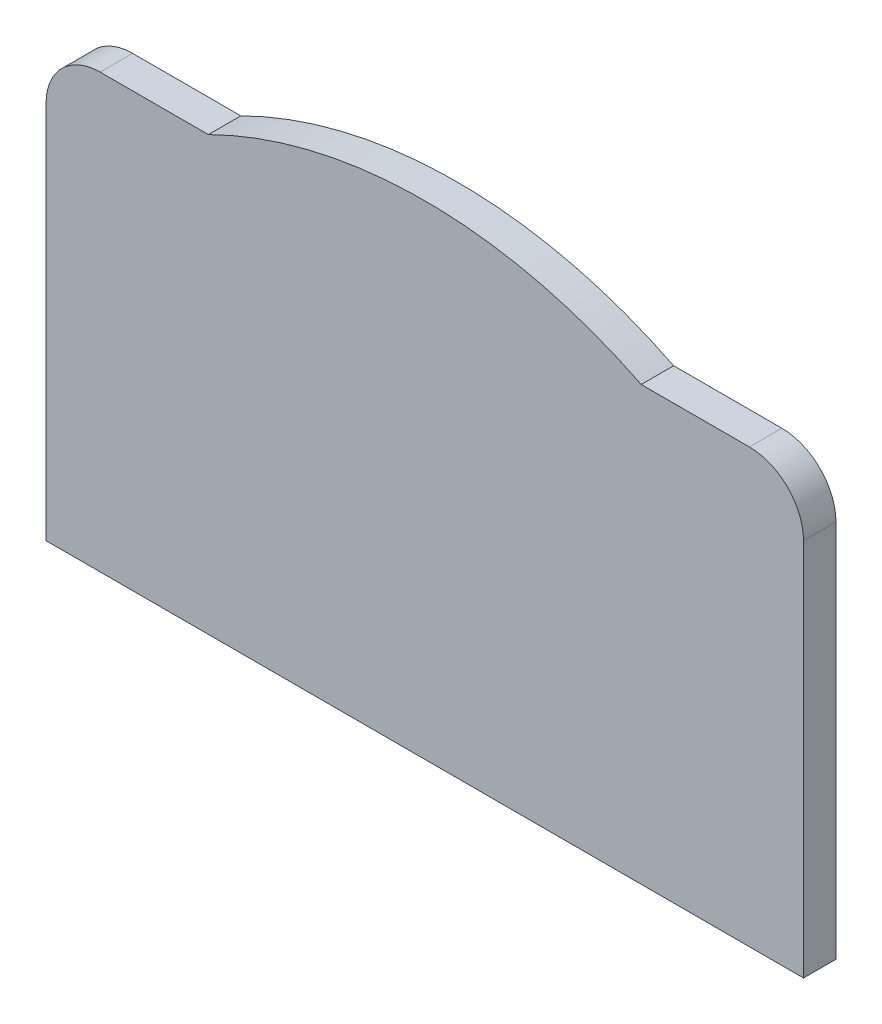
from build123d import *

# Parameters (mm, degrees)
ESQUISSE1_W      = 140
ESQUISSE1_H      = 80
EXTRUSION1_DEPTH = 6
CONG_1_R         = 10
EXTRUSION2_DEPTH = 6


with BuildPart() as part:
    # Esquisse1 → Extrusion1 (new body)
    with BuildSketch(Plane.XY):
        with Locations((10, 0)):
            Rectangle(ESQUISSE1_W, ESQUISSE1_H)
    extrude(amount=EXTRUSION1_DEPTH)

    # Congé1
    cong_1_edges = [part.edges().sort_by_distance(p)[0] for p in [
        (-60, 40, 3),
        (80, 40, 3),
    ]]
    fillet(cong_1_edges, radius=CONG_1_R)

    # Esquisse6 → Extrusion2 (add)
    with BuildSketch(Plane(origin=(0, 0, 0), x_dir=(-1, 0, 0), z_dir=(0, 0, -1))):
        with BuildLine():
            Line((-50, 40), (30, 40))
            ThreePointArc((30, 40), (-10, 49.417796635), (-50, 40))
        make_face()
    extrude(amount=-EXTRUSION2_DEPTH)


solid = part.part
